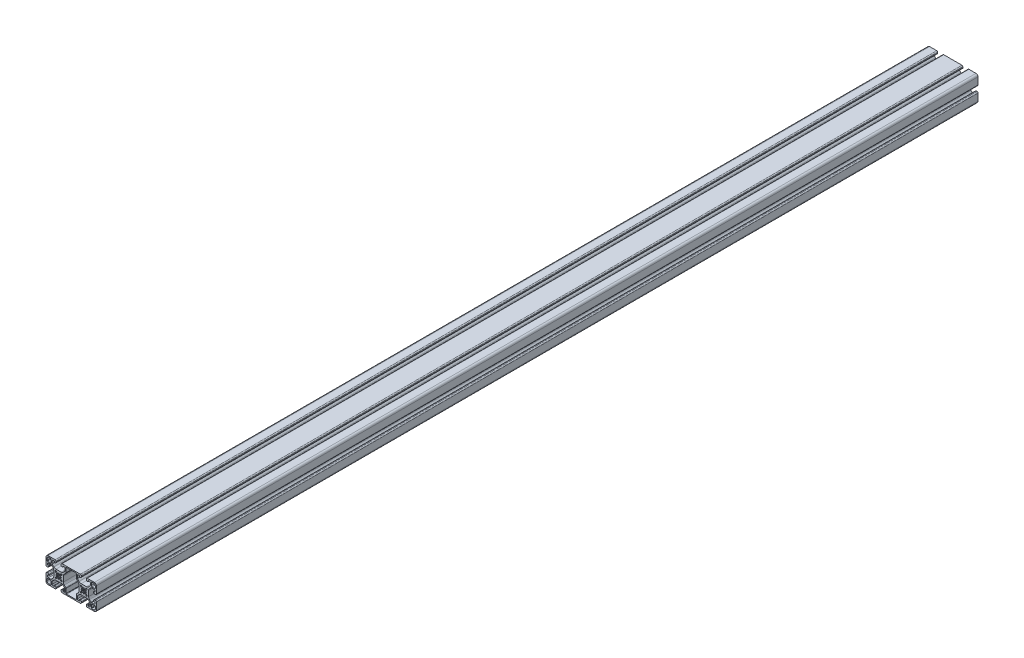
from build123d import *

# Parameters (mm, degrees)
EXTRUDE1_DEPTH = 1400


with BuildPart() as part:
    # Sketch1 → Extrude1 (new body)
    with BuildSketch(Plane.XY):
        with BuildLine():
            Line((-44, -18.484793301), (-44, -17.255))
            ThreePointArc((-44, -17.255), (-44.459842354, -16.144842354), (-45.57, -15.685))
            Line((-45.57, -15.685), (-46.474, -15.685))
            ThreePointArc((-46.474, -15.685), (-46.743407684, -15.796592316), (-46.855, -16.066))
            Line((-46.855, -16.066), (-46.855, -17.119))
            ThreePointArc((-46.855, -17.119), (-46.966592316, -17.388407684), (-47.236, -17.5))
            Line((-47.236, -17.5), (-49.015, -17.5))
            ThreePointArc((-49.015, -17.5), (-49.913025612, -17.128025612), (-50.285, -16.23))
            Line((-50.285, -16.23), (-50.285, -12.216214636))
            ThreePointArc((-50.285, -12.216214636), (-50.217252784, -11.875626381), (-50.024325035, -11.5868896))
            Line((-50.024325035, -11.5868896), (-47.513678224, -9.076242789))
            ThreePointArc((-47.513678224, -9.076242789), (-45.972667317, -8.046572221), (-44.154921014, -7.685))
            Line((-44.154921014, -7.685), (-35.845078986, -7.685))
            ThreePointArc((-35.845078986, -7.685), (-34.027332683, -8.046572221), (-32.486321776, -9.076242789))
            Line((-32.486321776, -9.076242789), (-29.975674965, -11.5868896))
            ThreePointArc((-29.975674965, -11.5868896), (-29.782747216, -11.875626381), (-29.715, -12.216214636))
            Line((-29.715, -12.216214636), (-29.715, -16.23))
            ThreePointArc((-29.715, -16.23), (-30.086974388, -17.128025612), (-30.985, -17.5))
            Line((-30.985, -17.5), (-32.764, -17.5))
            ThreePointArc((-32.764, -17.5), (-33.033407684, -17.388407684), (-33.145, -17.119))
            Line((-33.145, -17.119), (-33.145, -16.066))
            ThreePointArc((-33.145, -16.066), (-33.256592316, -15.796592316), (-33.526, -15.685))
            Line((-33.526, -15.685), (-34.43, -15.685))
            ThreePointArc((-34.43, -15.685), (-35.540157646, -16.144842354), (-36, -17.255))
            Line((-36, -17.255), (-36, -18.484793301))
            ThreePointArc((-36, -18.484793301), (-35.521569689, -19.559363866), (-34.43095644, -20))
            Line((-34.43095644, -20), (-5.57, -20))
            ThreePointArc((-5.57, -20), (-4.459842354, -19.540157646), (-4, -18.43))
            Line((-4, -18.43), (-4, -17.255))
            ThreePointArc((-4, -17.255), (-4.459842354, -16.144842354), (-5.57, -15.685))
            Line((-5.57, -15.685), (-6.474, -15.685))
            ThreePointArc((-6.474, -15.685), (-6.743407684, -15.796592316), (-6.855, -16.066))
            Line((-6.855, -16.066), (-6.855, -17.119))
            ThreePointArc((-6.855, -17.119), (-6.966592316, -17.388407684), (-7.236, -17.5))
            Line((-7.236, -17.5), (-9.015, -17.5))
            ThreePointArc((-9.015, -17.5), (-9.913025612, -17.128025612), (-10.285, -16.23))
            Line((-10.285, -16.23), (-10.285, -12.216214636))
            ThreePointArc((-10.285, -12.216214636), (-10.217252784, -11.875626381), (-10.024325035, -11.5868896))
            Line((-10.024325035, -11.5868896), (-7.513678224, -9.076242789))
            ThreePointArc((-7.513678224, -9.076242789), (-5.972667317, -8.046572221), (-4.154921014, -7.685))
            Line((-4.154921014, -7.685), (4.154921014, -7.685))
            ThreePointArc((4.154921014, -7.685), (5.972667317, -8.046572221), (7.513678224, -9.076242789))
            Line((7.513678224, -9.076242789), (10.024325035, -11.5868896))
            ThreePointArc((10.024325035, -11.5868896), (10.217252784, -11.875626381), (10.285, -12.216214636))
            Line((10.285, -12.216214636), (10.285, -16.23))
            ThreePointArc((10.285, -16.23), (9.913025612, -17.128025612), (9.015, -17.5))
            Line((9.015, -17.5), (7.236, -17.5))
            ThreePointArc((7.236, -17.5), (6.966592316, -17.388407684), (6.855, -17.119))
            Line((6.855, -17.119), (6.855, -16.066))
            ThreePointArc((6.855, -16.066), (6.743407684, -15.796592316), (6.474, -15.685))
            Line((6.474, -15.685), (5.57, -15.685))
            ThreePointArc((5.57, -15.685), (4.459842354, -16.144842354), (4, -17.255))
            Line((4, -17.255), (4, -18.43))
            ThreePointArc((4, -18.43), (4.459842354, -19.540157646), (5.57, -20))
            Line((5.57, -20), (16.83, -20))
            ThreePointArc((16.83, -20), (19.071528496, -19.071528496), (20, -16.83))
            Line((20, -16.83), (20, -5.57))
            ThreePointArc((20, -5.57), (19.540157646, -4.459842354), (18.43, -4))
            Line((18.43, -4), (17.255, -4))
            ThreePointArc((17.255, -4), (16.144842354, -4.459842354), (15.685, -5.57))
            Line((15.685, -5.57), (15.685, -6.474))
            ThreePointArc((15.685, -6.474), (15.796592316, -6.743407684), (16.066, -6.855))
            Line((16.066, -6.855), (17.119, -6.855))
            ThreePointArc((17.119, -6.855), (17.388407684, -6.966592316), (17.5, -7.236))
            Line((17.5, -7.236), (17.5, -9.015))
            ThreePointArc((17.5, -9.015), (17.128025612, -9.913025612), (16.23, -10.285))
            Line((16.23, -10.285), (12.216214636, -10.285))
            ThreePointArc((12.216214636, -10.285), (11.875626381, -10.217252784), (11.5868896, -10.024325035))
            Line((11.5868896, -10.024325035), (9.076242789, -7.513678224))
            ThreePointArc((9.076242789, -7.513678224), (8.046572221, -5.972667317), (7.685, -4.154921014))
            Line((7.685, -4.154921014), (7.685, 4.154921014))
            ThreePointArc((7.685, 4.154921014), (8.046572221, 5.972667317), (9.076242789, 7.513678224))
            Line((9.076242789, 7.513678224), (11.5868896, 10.024325035))
            ThreePointArc((11.5868896, 10.024325035), (11.875626381, 10.217252784), (12.216214636, 10.285))
            Line((12.216214636, 10.285), (16.23, 10.285))
            ThreePointArc((16.23, 10.285), (17.128025612, 9.913025612), (17.5, 9.015))
            Line((17.5, 9.015), (17.5, 7.236))
            ThreePointArc((17.5, 7.236), (17.388407684, 6.966592316), (17.119, 6.855))
            Line((17.119, 6.855), (16.066, 6.855))
            ThreePointArc((16.066, 6.855), (15.796592316, 6.743407684), (15.685, 6.474))
            Line((15.685, 6.474), (15.685, 5.57))
            ThreePointArc((15.685, 5.57), (16.144842354, 4.459842354), (17.255, 4))
            Line((17.255, 4), (18.43, 4))
            ThreePointArc((18.43, 4), (19.540157646, 4.459842354), (20, 5.57))
            Line((20, 5.57), (20, 16.83))
            ThreePointArc((20, 16.83), (19.071528496, 19.071528496), (16.83, 20))
            Line((16.83, 20), (5.57, 20))
            ThreePointArc((5.57, 20), (4.459842354, 19.540157646), (4, 18.43))
            Line((4, 18.43), (4, 17.255))
            ThreePointArc((4, 17.255), (4.459842354, 16.144842354), (5.57, 15.685))
            Line((5.57, 15.685), (6.474, 15.685))
            ThreePointArc((6.474, 15.685), (6.743407684, 15.796592316), (6.855, 16.066))
            Line((6.855, 16.066), (6.855, 17.119))
            ThreePointArc((6.855, 17.119), (6.966592316, 17.388407684), (7.236, 17.5))
            Line((7.236, 17.5), (9.015, 17.5))
            ThreePointArc((9.015, 17.5), (9.913025612, 17.128025612), (10.285, 16.23))
            Line((10.285, 16.23), (10.285, 12.216214636))
            ThreePointArc((10.285, 12.216214636), (10.217252784, 11.875626381), (10.024325035, 11.5868896))
            Line((10.024325035, 11.5868896), (7.513678224, 9.076242789))
            ThreePointArc((7.513678224, 9.076242789), (5.972667317, 8.046572221), (4.154921014, 7.685))
            Line((4.154921014, 7.685), (-4.154921014, 7.685))
            ThreePointArc((-4.154921014, 7.685), (-5.972667317, 8.046572221), (-7.513678224, 9.076242789))
            Line((-7.513678224, 9.076242789), (-10.024325035, 11.5868896))
            ThreePointArc((-10.024325035, 11.5868896), (-10.217252784, 11.875626381), (-10.285, 12.216214636))
            Line((-10.285, 12.216214636), (-10.285, 16.23))
            ThreePointArc((-10.285, 16.23), (-9.913025612, 17.128025612), (-9.015, 17.5))
            Line((-9.015, 17.5), (-7.236, 17.5))
            ThreePointArc((-7.236, 17.5), (-6.966592316, 17.388407684), (-6.855, 17.119))
            Line((-6.855, 17.119), (-6.855, 16.066))
            ThreePointArc((-6.855, 16.066), (-6.743407684, 15.796592316), (-6.474, 15.685))
            Line((-6.474, 15.685), (-5.57, 15.685))
            ThreePointArc((-5.57, 15.685), (-4.459842354, 16.144842354), (-4, 17.255))
            Line((-4, 17.255), (-4, 18.43))
            ThreePointArc((-4, 18.43), (-4.459842354, 19.540157646), (-5.57, 20))
            Line((-5.57, 20), (-34.43, 20))
            ThreePointArc((-34.43, 20), (-35.540157646, 19.540157646), (-36, 18.43))
            Line((-36, 18.43), (-36, 17.255))
            ThreePointArc((-36, 17.255), (-35.540157646, 16.144842354), (-34.43, 15.685))
            Line((-34.43, 15.685), (-33.526, 15.685))
            ThreePointArc((-33.526, 15.685), (-33.256592316, 15.796592316), (-33.145, 16.066))
            Line((-33.145, 16.066), (-33.145, 17.119))
            ThreePointArc((-33.145, 17.119), (-33.033407684, 17.388407684), (-32.764, 17.5))
            Line((-32.764, 17.5), (-30.985, 17.5))
            ThreePointArc((-30.985, 17.5), (-30.086974388, 17.128025612), (-29.715, 16.23))
            Line((-29.715, 16.23), (-29.715, 12.216214636))
            ThreePointArc((-29.715, 12.216214636), (-29.782747216, 11.875626381), (-29.975674965, 11.5868896))
            Line((-29.975674965, 11.5868896), (-32.486321776, 9.076242789))
            ThreePointArc((-32.486321776, 9.076242789), (-34.027332683, 8.046572221), (-35.845078986, 7.685))
            Line((-35.845078986, 7.685), (-44.154921014, 7.685))
            ThreePointArc((-44.154921014, 7.685), (-45.972667317, 8.046572221), (-47.513678224, 9.076242789))
            Line((-47.513678224, 9.076242789), (-50.024325035, 11.5868896))
            ThreePointArc((-50.024325035, 11.5868896), (-50.217252784, 11.875626381), (-50.285, 12.216214636))
            Line((-50.285, 12.216214636), (-50.285, 16.23))
            ThreePointArc((-50.285, 16.23), (-49.913025612, 17.128025612), (-49.015, 17.5))
            Line((-49.015, 17.5), (-47.236, 17.5))
            ThreePointArc((-47.236, 17.5), (-46.966592316, 17.388407684), (-46.855, 17.119))
            Line((-46.855, 17.119), (-46.855, 16.066))
            ThreePointArc((-46.855, 16.066), (-46.743407684, 15.796592316), (-46.474, 15.685))
            Line((-46.474, 15.685), (-45.57, 15.685))
            ThreePointArc((-45.57, 15.685), (-44.459842354, 16.144842354), (-44, 17.255))
            Line((-44, 17.255), (-44, 18.43))
            ThreePointArc((-44, 18.43), (-44.459842354, 19.540157646), (-45.57, 20))
            Line((-45.57, 20), (-56.83, 20))
            ThreePointArc((-56.83, 20), (-59.071528496, 19.071528496), (-60, 16.83))
            Line((-60, 16.83), (-60, 5.57))
            ThreePointArc((-60, 5.57), (-59.540157646, 4.459842354), (-58.43, 4))
            Line((-58.43, 4), (-57.255, 4))
            ThreePointArc((-57.255, 4), (-56.144842354, 4.459842354), (-55.685, 5.57))
            Line((-55.685, 5.57), (-55.685, 6.474))
            ThreePointArc((-55.685, 6.474), (-55.796592316, 6.743407684), (-56.066, 6.855))
            Line((-56.066, 6.855), (-57.119, 6.855))
            ThreePointArc((-57.119, 6.855), (-57.388407684, 6.966592316), (-57.5, 7.236))
            Line((-57.5, 7.236), (-57.5, 9.015))
            ThreePointArc((-57.5, 9.015), (-57.128025612, 9.913025612), (-56.23, 10.285))
            Line((-56.23, 10.285), (-52.216214636, 10.285))
            ThreePointArc((-52.216214636, 10.285), (-51.875626381, 10.217252784), (-51.5868896, 10.024325035))
            Line((-51.5868896, 10.024325035), (-49.076242789, 7.513678224))
            ThreePointArc((-49.076242789, 7.513678224), (-48.046572221, 5.972667317), (-47.685, 4.154921014))
            Line((-47.685, 4.154921014), (-47.685, -4.154921014))
            ThreePointArc((-47.685, -4.154921014), (-48.046572221, -5.972667317), (-49.076242789, -7.513678224))
            Line((-49.076242789, -7.513678224), (-51.5868896, -10.024325035))
            ThreePointArc((-51.5868896, -10.024325035), (-51.875626381, -10.217252784), (-52.216214636, -10.285))
            Line((-52.216214636, -10.285), (-56.23, -10.285))
            ThreePointArc((-56.23, -10.285), (-57.128025612, -9.913025612), (-57.5, -9.015))
            Line((-57.5, -9.015), (-57.5, -7.236))
            ThreePointArc((-57.5, -7.236), (-57.388407684, -6.966592316), (-57.119, -6.855))
            Line((-57.119, -6.855), (-56.066, -6.855))
            ThreePointArc((-56.066, -6.855), (-55.796592316, -6.743407684), (-55.685, -6.474))
            Line((-55.685, -6.474), (-55.685, -5.57))
            ThreePointArc((-55.685, -5.57), (-56.144842354, -4.459842354), (-57.255, -4))
            Line((-57.255, -4), (-58.43, -4))
            ThreePointArc((-58.43, -4), (-59.540157646, -4.459842354), (-60, -5.57))
            Line((-60, -5.57), (-60, -16.83))
            ThreePointArc((-60, -16.83), (-59.071528496, -19.071528496), (-56.83, -20))
            Line((-56.83, -20), (-45.56904356, -20))
            ThreePointArc((-45.56904356, -20), (-44.478430311, -19.559363866), (-44, -18.484793301))
        make_face()
        with BuildLine():
            Line((15.545, -18.345), (12.4898, -18.345))
            ThreePointArc((12.4898, -18.345), (12.044322728, -18.160477272), (11.8598, -17.715))
            Line((11.8598, -17.715), (11.8598, -13.1298))
            ThreePointArc((11.8598, -13.1298), (12.231774388, -12.231774388), (13.1298, -11.8598))
            Line((13.1298, -11.8598), (17.715, -11.8598))
            ThreePointArc((17.715, -11.8598), (18.160477272, -12.044322728), (18.345, -12.4898))
            Line((18.345, -12.4898), (18.345, -15.545))
            ThreePointArc((18.345, -15.545), (17.524898987, -17.524898987), (15.545, -18.345))
        make_face(mode=Mode.SUBTRACT)
        with BuildLine():
            Line((-11.8598, 17.715), (-11.8598, 10.823286659))
            ThreePointArc((-11.8598, 10.823286659), (-11.763127006, 10.3372787), (-11.487825612, 9.925261047))
            Line((-11.487825612, 9.925261047), (-9.076242789, 7.513678224))
            ThreePointArc((-9.076242789, 7.513678224), (-8.046572221, 5.972667317), (-7.685, 4.154921014))
            Line((-7.685, 4.154921014), (-7.685, -4.154921014))
            ThreePointArc((-7.685, -4.154921014), (-8.046572221, -5.972667317), (-9.076242789, -7.513678224))
            Line((-9.076242789, -7.513678224), (-11.487825612, -9.925261047))
            ThreePointArc((-11.487825612, -9.925261047), (-11.763127006, -10.3372787), (-11.8598, -10.823286659))
            Line((-11.8598, -10.823286659), (-11.8598, -17.715))
            ThreePointArc((-11.8598, -17.715), (-12.044322728, -18.160477272), (-12.4898, -18.345))
            Line((-12.4898, -18.345), (-27.5102, -18.345))
            ThreePointArc((-27.5102, -18.345), (-27.955677272, -18.160477272), (-28.1402, -17.715))
            Line((-28.1402, -17.715), (-28.1402, -10.823286659))
            ThreePointArc((-28.1402, -10.823286659), (-28.236872994, -10.3372787), (-28.512174388, -9.925261047))
            Line((-28.512174388, -9.925261047), (-30.923757211, -7.513678224))
            ThreePointArc((-30.923757211, -7.513678224), (-31.953427779, -5.972667317), (-32.315, -4.154921014))
            Line((-32.315, -4.154921014), (-32.315, 4.154921014))
            ThreePointArc((-32.315, 4.154921014), (-31.953427779, 5.972667317), (-30.923757211, 7.513678224))
            Line((-30.923757211, 7.513678224), (-28.512174388, 9.925261047))
            ThreePointArc((-28.512174388, 9.925261047), (-28.236872994, 10.3372787), (-28.1402, 10.823286659))
            Line((-28.1402, 10.823286659), (-28.1402, 17.715))
            ThreePointArc((-28.1402, 17.715), (-27.955677272, 18.160477272), (-27.5102, 18.345))
            Line((-27.5102, 18.345), (-12.4898, 18.345))
            ThreePointArc((-12.4898, 18.345), (-12.044322728, 18.160477272), (-11.8598, 17.715))
        make_face(mode=Mode.SUBTRACT)
        with BuildLine():
            Line((-58.345, -15.545), (-58.345, -12.4898))
            ThreePointArc((-58.345, -12.4898), (-58.160477272, -12.044322728), (-57.715, -11.8598))
            Line((-57.715, -11.8598), (-53.1298, -11.8598))
            ThreePointArc((-53.1298, -11.8598), (-52.231774388, -12.231774388), (-51.8598, -13.1298))
            Line((-51.8598, -13.1298), (-51.8598, -17.715))
            ThreePointArc((-51.8598, -17.715), (-52.044322728, -18.160477272), (-52.4898, -18.345))
            Line((-52.4898, -18.345), (-55.545, -18.345))
            ThreePointArc((-55.545, -18.345), (-57.524898987, -17.524898987), (-58.345, -15.545))
        make_face(mode=Mode.SUBTRACT)
        with BuildLine():
            Line((-55.545, 18.345), (-52.4898, 18.345))
            ThreePointArc((-52.4898, 18.345), (-52.044322728, 18.160477272), (-51.8598, 17.715))
            Line((-51.8598, 17.715), (-51.8598, 13.1298))
            ThreePointArc((-51.8598, 13.1298), (-52.231774388, 12.231774388), (-53.1298, 11.8598))
            Line((-53.1298, 11.8598), (-57.715, 11.8598))
            ThreePointArc((-57.715, 11.8598), (-58.160477272, 12.044322728), (-58.345, 12.4898))
            Line((-58.345, 12.4898), (-58.345, 15.545))
            ThreePointArc((-58.345, 15.545), (-57.524898987, 17.524898987), (-55.545, 18.345))
        make_face(mode=Mode.SUBTRACT)
        with BuildLine():
            Line((18.345, 15.545), (18.345, 12.4898))
            ThreePointArc((18.345, 12.4898), (18.160477272, 12.044322728), (17.715, 11.8598))
            Line((17.715, 11.8598), (13.1298, 11.8598))
            ThreePointArc((13.1298, 11.8598), (12.231774388, 12.231774388), (11.8598, 13.1298))
            Line((11.8598, 13.1298), (11.8598, 17.715))
            ThreePointArc((11.8598, 17.715), (12.044322728, 18.160477272), (12.4898, 18.345))
            Line((12.4898, 18.345), (15.545, 18.345))
            ThreePointArc((15.545, 18.345), (17.524898987, 17.524898987), (18.345, 15.545))
        make_face(mode=Mode.SUBTRACT)
        with BuildLine():
            Line((-34.873747818, -3.712038616), (-34.560690261, -4.84811685))
            ThreePointArc((-34.560690261, -4.84811685), (-34.696699139, -5.303300857), (-35.151883146, -5.43930974))
            Line((-35.151883146, -5.43930974), (-36.28796138, -5.126252183))
            Line((-36.28796138, -5.126252183), (-38.409281723, -3.00493184))
            ThreePointArc((-38.409281723, -3.00493184), (-38.879390357, -3.210020877), (-39.375, -3.34206149))
            Line((-39.375, -3.34206149), (-39.507740766, -4.087640441))
            ThreePointArc((-39.507740766, -4.087640441), (-40, -4.5), (-40.492259234, -4.087640441))
            Line((-40.492259234, -4.087640441), (-40.625, -3.34206149))
            ThreePointArc((-40.625, -3.34206149), (-41.120609643, -3.210020877), (-41.590718277, -3.00493184))
            Line((-41.590718277, -3.00493184), (-43.71203862, -5.126252183))
            Line((-43.71203862, -5.126252183), (-44.848116854, -5.43930974))
            ThreePointArc((-44.848116854, -5.43930974), (-45.303300871, -5.303300847), (-45.439309734, -4.848116822))
            Line((-45.439309734, -4.848116822), (-45.126252208, -3.712038579))
            Line((-45.126252208, -3.712038579), (-43.004931858, -1.590718243))
            ThreePointArc((-43.004931858, -1.590718243), (-43.210020883, -1.120609625), (-43.34206149, -0.625))
            Line((-43.34206149, -0.625), (-44.087640441, -0.492259234))
            ThreePointArc((-44.087640441, -0.492259234), (-44.5, 0), (-44.087640441, 0.492259234))
            Line((-44.087640441, 0.492259234), (-43.34206149, 0.625))
            ThreePointArc((-43.34206149, 0.625), (-43.210020877, 1.120609643), (-43.00493184, 1.590718277))
            Line((-43.00493184, 1.590718277), (-45.126252183, 3.71203862))
            Line((-45.126252183, 3.71203862), (-45.43930974, 4.848116854))
            ThreePointArc((-45.43930974, 4.848116854), (-45.303300847, 5.303300871), (-44.848116822, 5.439309734))
            Line((-44.848116822, 5.439309734), (-43.712038579, 5.126252209))
            Line((-43.712038579, 5.126252209), (-41.590718243, 3.004931858))
            ThreePointArc((-41.590718243, 3.004931858), (-41.120609625, 3.210020883), (-40.625, 3.34206149))
            Line((-40.625, 3.34206149), (-40.492259234, 4.087640441))
            ThreePointArc((-40.492259234, 4.087640441), (-40, 4.5), (-39.507740766, 4.087640441))
            Line((-39.507740766, 4.087640441), (-39.375, 3.34206149))
            ThreePointArc((-39.375, 3.34206149), (-38.879390364, 3.210020879), (-38.409281735, 3.004931846))
            Line((-38.409281735, 3.004931846), (-36.287961384, 5.126252182))
            Line((-36.287961384, 5.126252182), (-35.15188315, 5.43930974))
            ThreePointArc((-35.15188315, 5.43930974), (-34.696699143, 5.303300861), (-34.56069026, 4.848116854))
            Line((-34.56069026, 4.848116854), (-34.873747817, 3.71203862))
            Line((-34.873747817, 3.71203862), (-36.99506816, 1.590718277))
            ThreePointArc((-36.99506816, 1.590718277), (-36.789979123, 1.120609643), (-36.65793851, 0.625))
            Line((-36.65793851, 0.625), (-35.912359559, 0.492259234))
            ThreePointArc((-35.912359559, 0.492259234), (-35.5, 0), (-35.912359559, -0.492259234))
            Line((-35.912359559, -0.492259234), (-36.65793851, -0.625))
            ThreePointArc((-36.65793851, -0.625), (-36.789979121, -1.120609636), (-36.995068154, -1.590718265))
            Line((-36.995068154, -1.590718265), (-34.873747818, -3.712038616))
        make_face(mode=Mode.SUBTRACT)
        with BuildLine():
            Line((5.126252183, -3.712038621), (5.43930974, -4.848116855))
            ThreePointArc((5.43930974, -4.848116855), (5.303300859, -5.303300859), (4.848116855, -5.439309741))
            Line((4.848116855, -5.439309741), (3.712038621, -5.126252182))
            Line((3.712038621, -5.126252182), (1.590718278, -3.00493184))
            ThreePointArc((1.590718278, -3.00493184), (1.120609643, -3.210020877), (0.625, -3.34206149))
            Line((0.625, -3.34206149), (0.492259234, -4.087640441))
            ThreePointArc((0.492259234, -4.087640441), (0, -4.5), (-0.492259234, -4.087640441))
            Line((-0.492259234, -4.087640441), (-0.625, -3.34206149))
            ThreePointArc((-0.625, -3.34206149), (-1.120609643, -3.210020877), (-1.590718277, -3.00493184))
            Line((-1.590718277, -3.00493184), (-3.71203862, -5.126252183))
            Line((-3.71203862, -5.126252183), (-4.848116854, -5.43930974))
            ThreePointArc((-4.848116854, -5.43930974), (-5.30330086, -5.30330086), (-5.439309742, -4.848116855))
            Line((-5.439309742, -4.848116855), (-5.126252183, -3.712038621))
            Line((-5.126252183, -3.712038621), (-3.004931839, -1.590718279))
            ThreePointArc((-3.004931839, -1.590718279), (-3.210020876, -1.120609644), (-3.34206149, -0.625))
            Line((-3.34206149, -0.625), (-4.087640441, -0.492259234))
            ThreePointArc((-4.087640441, -0.492259234), (-4.5, 0), (-4.087640441, 0.492259234))
            Line((-4.087640441, 0.492259234), (-3.34206149, 0.625))
            ThreePointArc((-3.34206149, 0.625), (-3.210020877, 1.120609643), (-3.00493184, 1.590718277))
            Line((-3.00493184, 1.590718277), (-5.126252183, 3.71203862))
            Line((-5.126252183, 3.71203862), (-5.439309741, 4.848116854))
            ThreePointArc((-5.439309741, 4.848116854), (-5.303300859, 5.303300859), (-4.848116854, 5.43930974))
            Line((-4.848116854, 5.43930974), (-3.712038621, 5.126252183))
            Line((-3.712038621, 5.126252183), (-1.590718277, 3.00493184))
            ThreePointArc((-1.590718277, 3.00493184), (-1.120609643, 3.210020877), (-0.625, 3.34206149))
            Line((-0.625, 3.34206149), (-0.492259234, 4.087640441))
            ThreePointArc((-0.492259234, 4.087640441), (0, 4.5), (0.492259234, 4.087640441))
            Line((0.492259234, 4.087640441), (0.625, 3.34206149))
            ThreePointArc((0.625, 3.34206149), (1.120609646, 3.210020876), (1.590718283, 3.004931837))
            Line((1.590718283, 3.004931837), (3.712038628, 5.126252178))
            Line((3.712038628, 5.126252178), (4.84811686, 5.439309741))
            ThreePointArc((4.84811686, 5.439309741), (5.303300861, 5.303300856), (5.43930974, 4.848116854))
            Line((5.43930974, 4.848116854), (5.126252183, 3.71203862))
            Line((5.126252183, 3.71203862), (3.00493184, 1.590718277))
            ThreePointArc((3.00493184, 1.590718277), (3.210020877, 1.120609643), (3.34206149, 0.625))
            Line((3.34206149, 0.625), (4.087640441, 0.492259234))
            ThreePointArc((4.087640441, 0.492259234), (4.5, 0), (4.087640441, -0.492259234))
            Line((4.087640441, -0.492259234), (3.34206149, -0.625))
            ThreePointArc((3.34206149, -0.625), (3.210020877, -1.120609643), (3.00493184, -1.590718278))
            Line((3.00493184, -1.590718278), (5.126252183, -3.712038621))
        make_face(mode=Mode.SUBTRACT)
    extrude(amount=-EXTRUDE1_DEPTH)


solid = part.part
